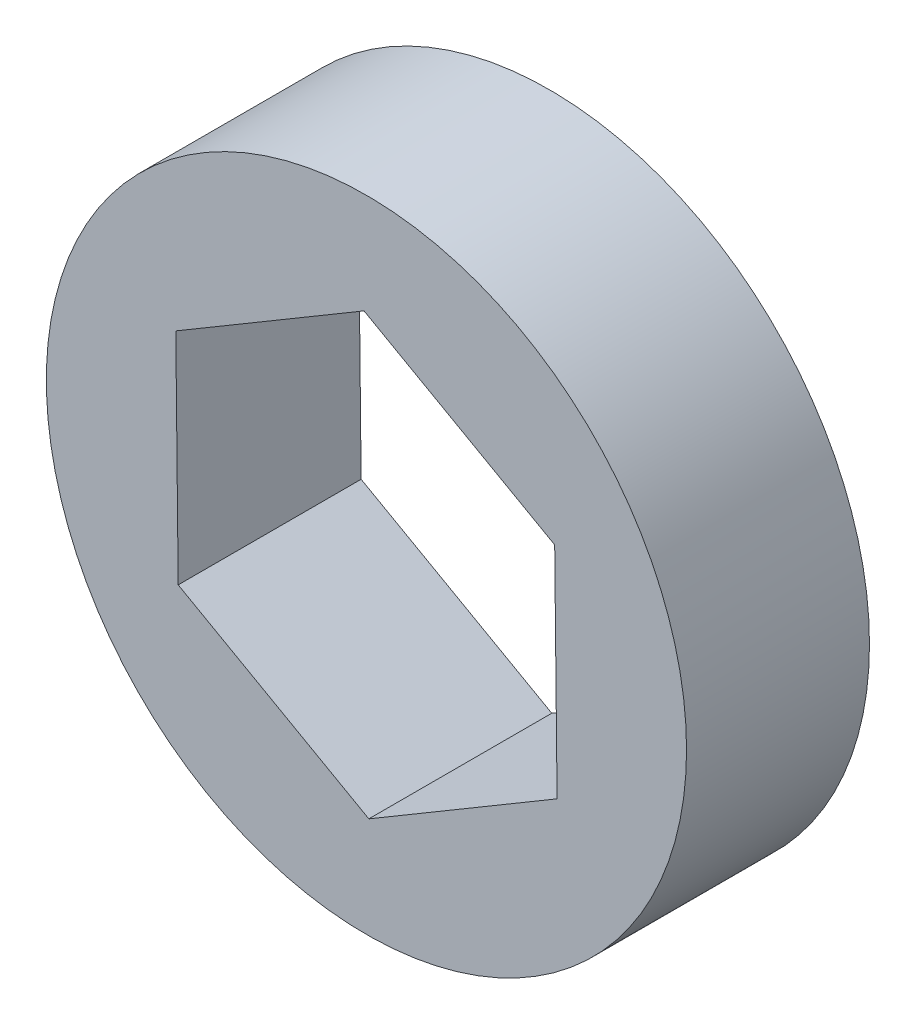
from build123d import *

# Parameters (mm, degrees)
SKETCH1_R           = 12.25
BOSS_EXTRUDE1_DEPTH = 7


with BuildPart() as part:
    # Sketch1 → Boss-Extrude1 (new body)
    with BuildSketch(Plane.XY):
        Circle(SKETCH1_R)
        Polygon((7.295414126, -4.106125433), (7.203715999, 4.264951247), (-0.091698127, 8.37107668), (-7.295414126, 4.106125433), (-7.203715999, -4.264951247), (0.091698127, -8.37107668), align=None, mode=Mode.SUBTRACT)
    extrude(amount=BOSS_EXTRUDE1_DEPTH)


solid = part.part
